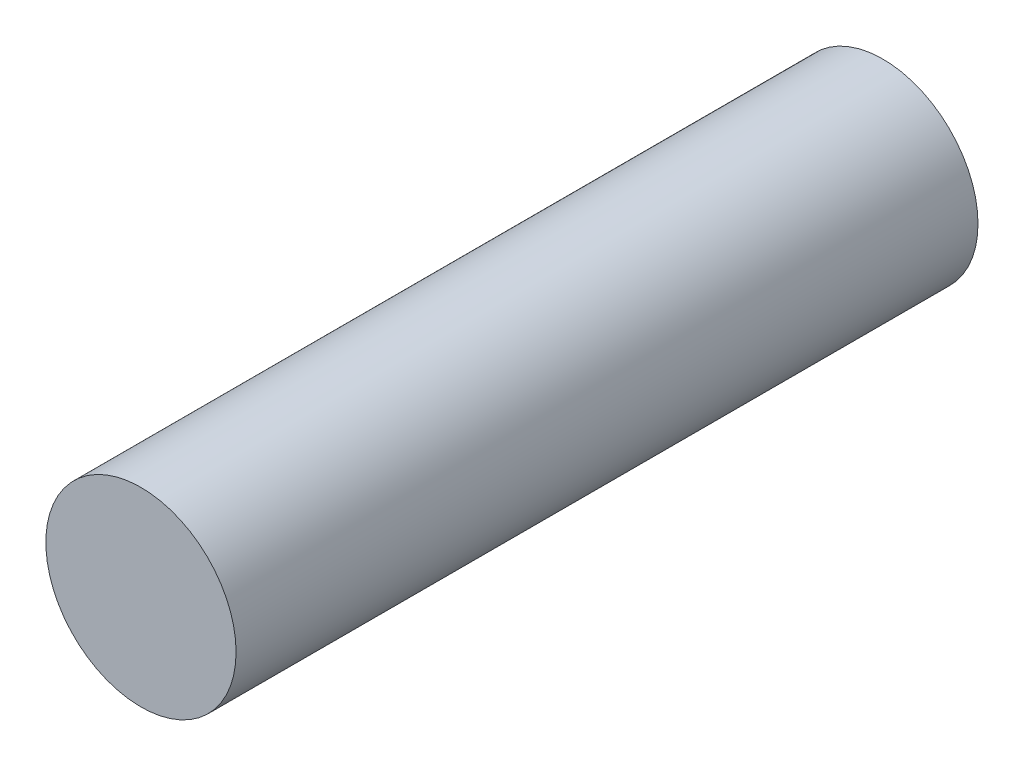
from build123d import *

# Parameters (mm, degrees)
SKETCH1_R           = 2.5
BOSS_EXTRUDE1_DEPTH = 19.5


with BuildPart() as part:
    # Sketch1 → Boss-Extrude1 (new body)
    with BuildSketch(Plane.XY):
        Circle(SKETCH1_R)
    extrude(amount=BOSS_EXTRUDE1_DEPTH)


solid = part.part
